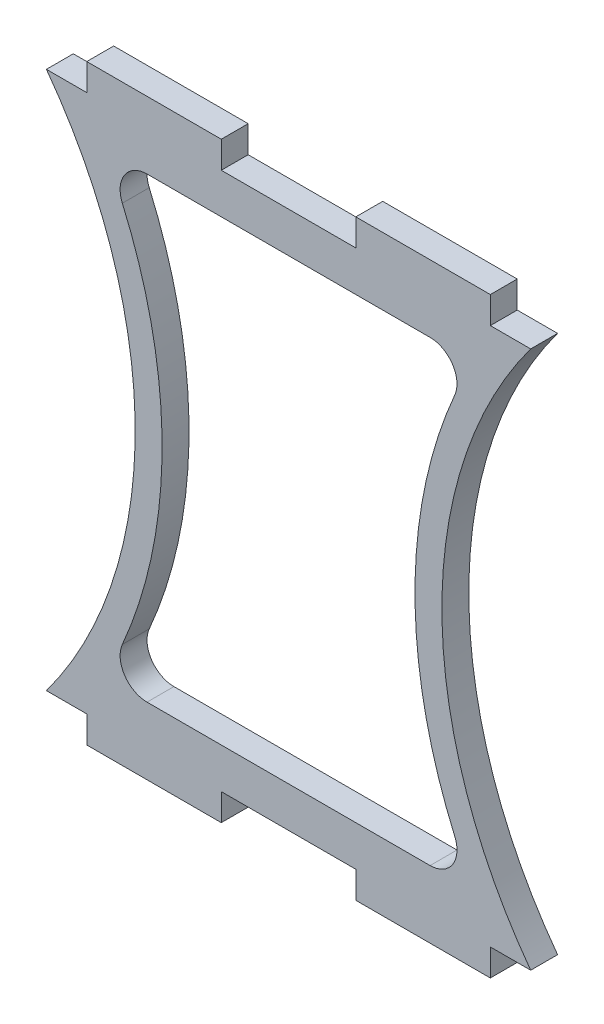
from build123d import *

# Parameters (mm, degrees)
BOSS_EXTRUDE1_DEPTH = 2


with BuildPart() as part:
    # Sketch1 → Boss-Extrude1 (new body)
    with BuildSketch(Plane.XY):
        with BuildLine():
            Line((-18, 20), (-15, 20))
            Line((-15, 20), (-15, 22))
            Line((-15, 22), (-5, 22))
            Line((-5, 22), (-5, 20))
            Line((-5, 20), (5, 20))
            Line((5, 20), (5, 22))
            Line((5, 22), (15, 22))
            Line((15, 22), (15, 20))
            Line((15, 20), (18, 20))
            ThreePointArc((18, 20), (11.399404767, 0), (18, -20))
            Line((18, -20), (15, -20))
            Line((15, -20), (15, -22))
            Line((15, -22), (5, -22))
            Line((5, -22), (5, -20))
            Line((5, -20), (-5, -20))
            Line((-5, -20), (-5, -22))
            Line((-5, -22), (-15, -22))
            Line((-15, -22), (-15, -20))
            Line((-15, -20), (-18, -20))
            ThreePointArc((-18, -20), (-11.399404767, 0), (-18, 20))
        make_face()
        with BuildLine():
            Line((-10.520951842, -17), (10.520951842, -17))
            ThreePointArc((10.520951842, -17), (12.193632239, -16.096421584), (12.354914733, -14.20214029))
            ThreePointArc((12.354914733, -14.20214029), (9.399404767, 0), (12.354914733, 14.20214029))
            ThreePointArc((12.354914733, 14.20214029), (12.193632239, 16.096421584), (10.520951842, 17))
            Line((10.520951842, 17), (-10.520951842, 17))
            ThreePointArc((-10.520951842, 17), (-12.193632239, 16.096421584), (-12.354914733, 14.20214029))
            ThreePointArc((-12.354914733, 14.20214029), (-9.399404767, 0), (-12.354914733, -14.20214029))
            ThreePointArc((-12.354914733, -14.20214029), (-12.193632239, -16.096421584), (-10.520951842, -17))
        make_face(mode=Mode.SUBTRACT)
    extrude(amount=BOSS_EXTRUDE1_DEPTH)


solid = part.part
